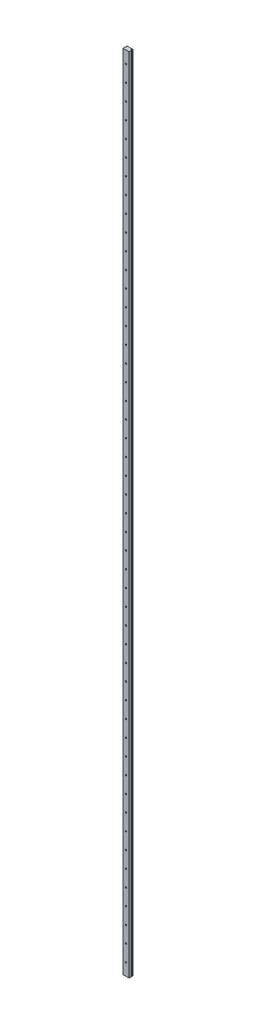
from build123d import *

# Parameters (mm, degrees)
BOSS_EXTRUDE1_DEPTH = 990
CHAMFER1_SIZE       = 0.5
LPATTERN1_COUNT     = 25
LPATTERN1_PITCH     = 40
LPATTERN1_COL_COUNT = 25
LPATTERN1_COL_PITCH = 40


with BuildPart() as part:
    # Sketch1 → Boss-Extrude1 (new, symmetric)
    with BuildSketch(Plane(origin=(0, 0, 0), x_dir=(1, 0, 0), z_dir=(0, 1, 0))):
        with BuildLine():
            Line((7.5, -5), (-7.5, -5))
            Line((-7.5, -5), (-7.5, 0.75))
            ThreePointArc((-7.5, 0.75), (-6.815346803, 0.954174967), (-6.354356076, 1.5))
            Line((-6.354356076, 1.5), (-5.5, 1.5))
            Line((-5.5, 1.5), (-5.5, 2.5))
            Line((-5.5, 2.5), (-6.354356076, 2.5))
            ThreePointArc((-6.354356076, 2.5), (-6.815346803, 3.045825033), (-7.5, 3.25))
            Line((-7.5, 3.25), (-7.5, 5))
            Line((-7.5, 5), (7.5, 5))
            Line((7.5, 5), (7.5, 3.25))
            ThreePointArc((7.5, 3.25), (6.815346803, 3.045825033), (6.354356076, 2.5))
            Line((6.354356076, 2.5), (5.5, 2.5))
            Line((5.5, 2.5), (5.5, 1.5))
            Line((5.5, 1.5), (6.354356076, 1.5))
            ThreePointArc((6.354356076, 1.5), (6.815346803, 0.954174967), (7.5, 0.75))
            Line((7.5, 0.75), (7.5, -5))
        make_face()
    extrude(amount=BOSS_EXTRUDE1_DEPTH, both=True)

    # Chamfer1
    chamfer1_edges = [part.edges().sort_by_distance(p)[0] for p in [
        (-7.5, 0, -5),
        (7.5, 0, -5),
        (7.5, 0, 5),
        (-7.5, 0, 5),
    ]]
    chamfer(chamfer1_edges, length=CHAMFER1_SIZE)

    # Sketch4 → CBORE for M3 Hex Socket Head Cap Screw1 (revolve, cut)
    with BuildSketch(Plane(origin=(0, 0, -5), x_dir=(0, 1, 0), z_dir=(1, 0, 0))):
        Polygon((0, 0), (0, 10), (1.7, 10), (1.7, 3.9), (3.25, 3.9), (3.25, 0.5), (3.75, 0), align=None)
    cbore_for_m3_hex_socket_head_cap_screw1 = revolve(axis=Axis((0, 0, -11.35), (0, 0, 1)), mode=Mode.SUBTRACT)

    # LPattern1: CBORE for M3 Hex Socket Head Cap Screw1 ×25
    with Locations(*[(0, -i * LPATTERN1_PITCH, 0) for i in range(1, LPATTERN1_COUNT)]):
        add(cbore_for_m3_hex_socket_head_cap_screw1, mode=Mode.SUBTRACT)

    # LPattern1 col: CBORE for M3 Hex Socket Head Cap Screw1 ×25
    with Locations(*[(0, i * LPATTERN1_COL_PITCH, 0) for i in range(1, LPATTERN1_COL_COUNT)]):
        add(cbore_for_m3_hex_socket_head_cap_screw1, mode=Mode.SUBTRACT)


solid = part.part
